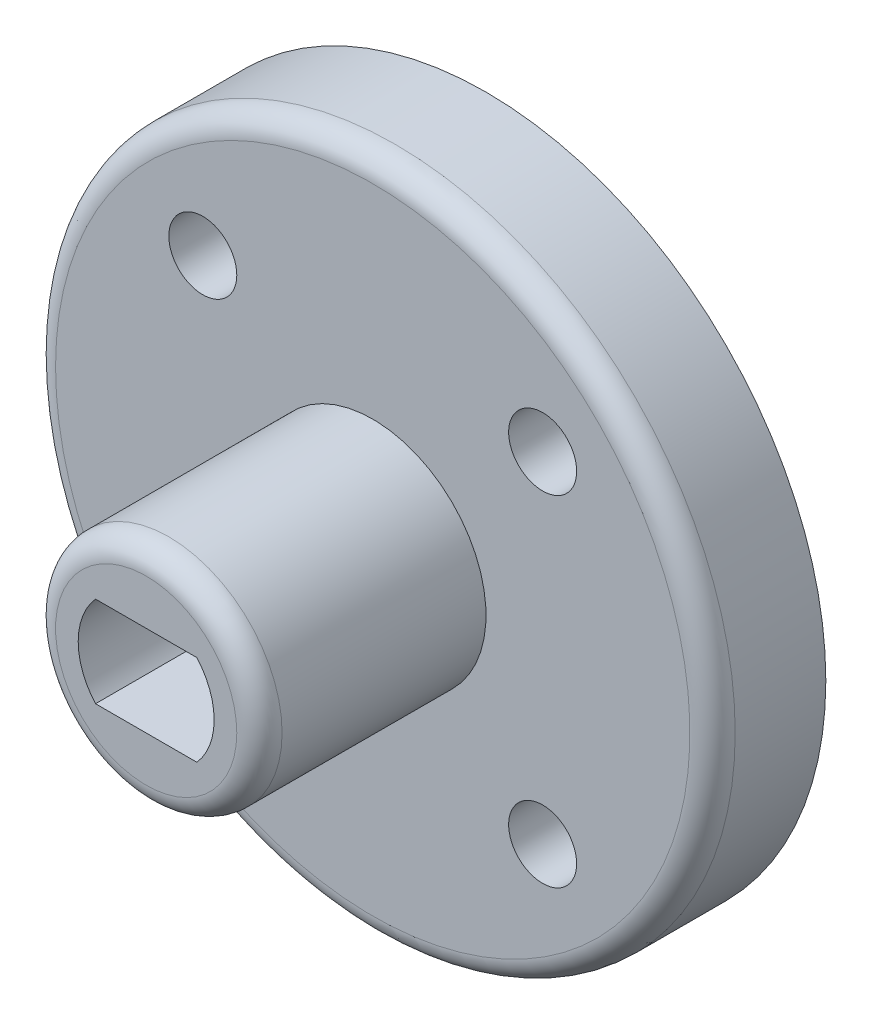
from build123d import *

# Parameters (mm, degrees)
CROQUIS1_R              = 5
SALIENTE_EXTRUIR1_DEPTH = 5
CROQUIS2_R              = 15
SALIENTE_EXTRUIR2_DEPTH = 5
CROQUIS3_R              = 1.5
CORTAR_EXTRUIR1_DEPTH   = 5
REDONDEO1_R             = 1
REDONDEO2_R             = 1


with BuildPart() as part:
    # Croquis1 → Saliente-Extruir1 (new, symmetric)
    with BuildSketch(Plane.XY):
        Circle(CROQUIS1_R)
        with BuildLine():
            Line((-2.236067977, -2), (2.236067977, -2))
            ThreePointArc((2.236067977, -2), (3, 0), (2.236067977, 2))
            Line((2.236067977, 2), (-2.236067977, 2))
            ThreePointArc((-2.236067977, 2), (-3, 0), (-2.236067977, -2))
        make_face(mode=Mode.SUBTRACT)
    extrude(amount=SALIENTE_EXTRUIR1_DEPTH, both=True)

    # Croquis2 → Saliente-Extruir2 (add)
    with BuildSketch(Plane(origin=(0, 0, -5), x_dir=(-1, 0, 0), z_dir=(0, 0, -1))):
        Circle(CROQUIS2_R)
    extrude(amount=SALIENTE_EXTRUIR2_DEPTH)

    # Croquis3 → Cortar-Extruir1 (cut)
    with BuildSketch(Plane.XY.offset(-5)):
        with Locations((-7.5, 7.5)):
            Circle(CROQUIS3_R)
        with Locations((7.5, 7.5)):
            Circle(CROQUIS3_R)
        with Locations((-7.5, -7.5)):
            Circle(CROQUIS3_R)
        with Locations((7.5, -7.5)):
            Circle(CROQUIS3_R)
    extrude(amount=-CORTAR_EXTRUIR1_DEPTH, mode=Mode.SUBTRACT)

    # Redondeo1
    redondeo1_edges = [part.edges().sort_by_distance(p)[0] for p in [
        (15, 0, -5),
    ]]
    fillet(redondeo1_edges, radius=REDONDEO1_R)

    # Redondeo2
    redondeo2_edges = [part.edges().sort_by_distance(p)[0] for p in [
        (-5, 0, 5),
    ]]
    fillet(redondeo2_edges, radius=REDONDEO2_R)


solid = part.part
